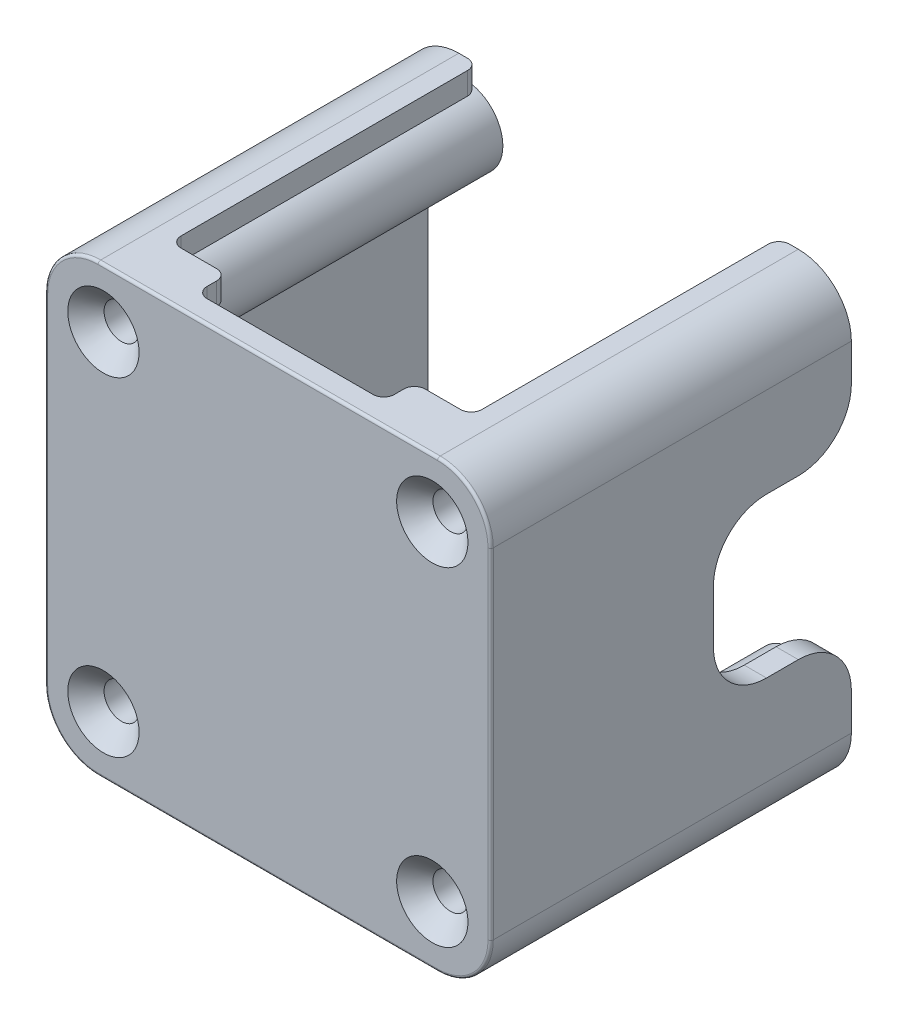
from build123d import *

# Parameters (mm, degrees)
CROQUIS1_W                                           = 42
CROQUIS1_H                                           = 42
SALIENTE_EXTRUIR1_DEPTH                              = 34
REDONDEO1_R                                          = 5
VACIADO1_T                                           = -2.1
CORTAR_EXTRUIR1_DEPTH                                = 59.974621346
CORTAR_EXTRUIR2_REACH                                = 62.087
CROQUIS4_W                                           = 13
CROQUIS4_H                                           = 15
REDONDEO2_R                                          = 5
REDONDEO3_R                                          = 1
REDONDEO4_R                                          = 0.25
CROQUIS5_R                                           = 3.65
SALIENTE_EXTRUIR2_DEPTH                              = 31.9
REFRENTADO_PARA_TORNILLO_TAP_N_CON_CABEZ_D           = 3.3
REFRENTADO_PARA_TORNILLO_TAP_N_CON_CABEZ_CSINK_D     = 6.72
REFRENTADO_PARA_TORNILLO_TAP_N_CON_CABEZ_CSINK_ANGLE = 90
CROQUIS16_R                                          = 1.3
SALIENTE_EXTRUIR3_DEPTH                              = 10


with BuildPart() as part:
    # Croquis1 → Saliente-Extruir1 (new body)
    with BuildSketch(Plane.XY):
        with Locations((2.622149837, 5.276923077)):
            Rectangle(CROQUIS1_W, CROQUIS1_H)
    extrude(amount=-SALIENTE_EXTRUIR1_DEPTH)

    # Redondeo1
    redondeo1_edges = [part.edges().sort_by_distance(p)[0] for p in [
        (-18.377850163, 26.276923077, -17),
        (23.622149837, 26.276923077, -17),
        (23.622149837, -15.723076923, -17),
        (-18.377850163, -15.723076923, -17),
    ]]
    fillet(redondeo1_edges, radius=REDONDEO1_R)

    # Vaciado1
    vaciado1_openings = [part.faces().sort_by_distance(p)[0] for p in [
        (2.622149837, 5.276923077, -34),
    ]]
    offset(amount=VACIADO1_T, openings=vaciado1_openings, kind=Kind.INTERSECTION)

    # Croquis2 → Cortar-Extruir1 (cut, through all)
    with BuildSketch(Plane(origin=(0, 26.276923077, 0), x_dir=(1, 0, 0), z_dir=(0, 1, 0))):
        Polygon((-11.557850163, 34), (16.792149837, 34), (16.792149837, 5), (11.442149837, 5), (11.442149837, 2.1), (-6.207850163, 2.1), (-6.207850163, 5), (-11.557850163, 5), align=None)
    extrude(amount=-CORTAR_EXTRUIR1_DEPTH, mode=Mode.SUBTRACT)

    # Croquis4 → Cortar-Extruir2 (cut, up to next)
    with BuildSketch(Plane(origin=(23.622149837, 0, 0), x_dir=(0, 0, -1), z_dir=(1, 0, 0)), mode=Mode.PRIVATE) as cortar_extruir2_sk1:
        with Locations((27.5, 5.276923077)):
            Rectangle(CROQUIS4_W, CROQUIS4_H)
    cortar_extruir2_tool1 = extrude(cortar_extruir2_sk1.sketch, amount=-CORTAR_EXTRUIR2_REACH, mode=Mode.PRIVATE) & part.part
    add(cortar_extruir2_tool1.solids().sort_by_distance((23.62215, 5.276923, -27.5))[0], mode=Mode.SUBTRACT)

    # Redondeo2
    redondeo2_edges = [part.edges().sort_by_distance(p)[0] for p in [
        (22.572149837, 12.776923077, -21),
        (22.572149837, -2.223076923, -21),
        (22.572149837, -2.223076923, -34),
        (22.572149837, 12.776923077, -34),
    ]]
    fillet(redondeo2_edges, radius=REDONDEO2_R)

    # Redondeo3
    redondeo3_edges = [part.edges().sort_by_distance(p)[0] for p in [
        (-11.557850163, 25.226923077, -5),
        (-11.557850163, -14.673076923, -5),
        (-11.557850163, 25.226923077, -34),
        (-11.557850163, -14.673076923, -34),
        (16.792149837, 25.226923077, -34),
        (16.792149837, -14.673076923, -34),
        (16.792149837, 25.226923077, -5),
        (16.792149837, -14.673076923, -5),
        (11.442149837, 25.226923077, -2.1),
        (11.442149837, -14.673076923, -2.1),
        (-6.207850163, 25.226923077, -5),
        (-6.207850163, -14.673076923, -5),
        (11.442149837, 25.226923077, -5),
        (11.442149837, -14.673076923, -5),
        (-6.207850163, 25.226923077, -2.1),
        (-6.207850163, -14.673076923, -2.1),
    ]]
    fillet(redondeo3_edges, radius=REDONDEO3_R)

    # Redondeo4
    redondeo4_edges = [part.edges().sort_by_distance(p)[0] for p in [
        (2.622149837, -15.723076923, 0),
        (-18.377850163, 5.276923077, 0),
        (23.622149837, 5.276923077, 0),
        (2.622149837, 26.276923077, 0),
        (22.157683743, 24.812456983, 0),
        (-16.913384069, 24.812456983, 0),
        (-16.913384069, -14.258610829, 0),
        (22.157683743, -14.258610829, 0),
    ]]
    fillet(redondeo4_edges, radius=REDONDEO4_R)

    # Croquis5 → Saliente-Extruir2 (add)
    with BuildSketch(Plane(origin=(0, 0, -2.1), x_dir=(-1, 0, 0), z_dir=(0, 0, -1))):
        with Locations((-18.122149837, 20.776923077)):
            Circle(CROQUIS5_R)
        with Locations((12.877850163, 20.776923077)):
            Circle(CROQUIS5_R)
        with Locations((-18.122149837, -10.223076923)):
            Circle(CROQUIS5_R)
        with Locations((12.877850163, -10.223076923)):
            Circle(CROQUIS5_R)
    extrude(amount=SALIENTE_EXTRUIR2_DEPTH)

    # Refrentado para tornillo tapón con cabeza plana de clavija de M31 (through all)
    with Locations(Plane.XY):
        with Locations((-12.877850163, 20.776923077), (-12.877850163, -10.223076923), (18.122149837, -10.223076923), (18.122149837, 20.776923077)):
            CounterSinkHole(REFRENTADO_PARA_TORNILLO_TAP_N_CON_CABEZ_D / 2, REFRENTADO_PARA_TORNILLO_TAP_N_CON_CABEZ_CSINK_D / 2, counter_sink_angle=REFRENTADO_PARA_TORNILLO_TAP_N_CON_CABEZ_CSINK_ANGLE)

    # Croquis16 → Saliente-Extruir3 (add)
    # profile 1 of 2: a face of its own
    with BuildSketch(Plane(origin=(0, 0, -2.1), x_dir=(-1, 0, 0), z_dir=(0, 0, -1))):
        with BuildLine():
            Line((-8.301696367, 14.817459435), (-8.301696367, 8.603842264))
            ThreePointArc((-8.301696367, 8.603842264), (-13.72041581, 11.71065085), (-8.301696367, 14.817459435))
        make_face()
        with Locations((-10.12041581, 11.71065085)):
            Circle(CROQUIS16_R, mode=Mode.SUBTRACT)
    # profile 2 of 2: a face of its own
    with BuildSketch(Plane(origin=(0, 0, -2.1), x_dir=(-1, 0, 0), z_dir=(0, 0, -1))):
        with BuildLine():
            Line((3.060124976, 14.818812033), (3.061604408, 8.605195038))
            ThreePointArc((3.061604408, 8.605195038), (8.479583981, 11.713293707), (3.060124976, 14.818812033))
        make_face()
        with Locations(Location((4.879584083, 11.712436564, 0), (0, 0, 180))):
            Circle(CROQUIS16_R, mode=Mode.SUBTRACT)
    extrude(amount=SALIENTE_EXTRUIR3_DEPTH)


solid = part.part
